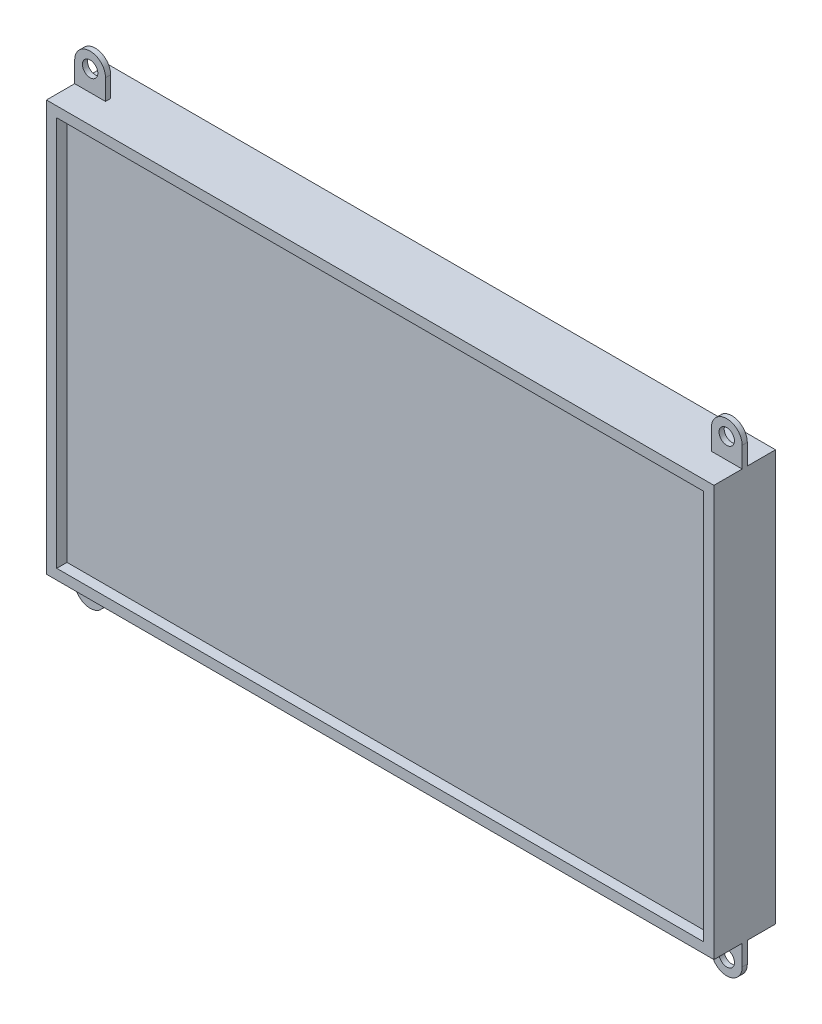
from build123d import *

# Parameters (mm, degrees)
SKETCH1_W               = 165.1
SKETCH1_H               = 101.6
BOSS_EXTRUDE1_DEPTH     = 7.62
SKETCH2_W               = 160.02
SKETCH2_H               = 96.52
CUT_EXTRUDE1_DEPTH      = 2.54
BOSS_EXTRUDE2_START     = -7.62
BOSS_EXTRUDE2_DEPTH     = 0.635
SKETCH4_R               = 1.905
CUT_EXTRUDE2_DEPTH      = 103.203442334
MIRROR2_START           = -7.62
MIRROR2_COPY_1_DEPTH    = 0.635
MIRROR2_COPY_2_SKETCH_R = 1.905
MIRROR2_COPY_2_DEPTH    = 103.203442334


with BuildPart() as part:
    # Sketch1 → Boss-Extrude1 (new, symmetric)
    with BuildSketch(Plane.XY):
        Rectangle(SKETCH1_W, SKETCH1_H)
    extrude(amount=BOSS_EXTRUDE1_DEPTH, both=True)

    # Sketch2 → Cut-Extrude1 (cut)
    with BuildSketch(Plane.XY.offset(7.62)):
        Rectangle(SKETCH2_W, SKETCH2_H)
    extrude(amount=-CUT_EXTRUDE1_DEPTH, mode=Mode.SUBTRACT)

    # Sketch3 → Boss-Extrude2 (add, symmetric)
    with BuildSketch(Plane(origin=(0, 0, -7.62), x_dir=(-1, 0, 0), z_dir=(0, 0, -1)).offset(BOSS_EXTRUDE2_START)):
        with BuildLine():
            Line((-82.55, 55.88), (-82.55, 50.8))
            Line((-82.55, 50.8), (-74.93, 50.8))
            Line((-74.93, 50.8), (-74.93, 55.88))
            ThreePointArc((-74.93, 55.88), (-78.74, 59.69), (-82.55, 55.88))
        make_face()
    boss_extrude2 = extrude(amount=BOSS_EXTRUDE2_DEPTH, both=True)

    # Sketch4 → Cut-Extrude2 (cut, through all)
    with BuildSketch(Plane.XY.offset(0.635)):
        with Locations((78.74, 55.88)):
            Circle(SKETCH4_R)
    cut_extrude2 = extrude(amount=-CUT_EXTRUDE2_DEPTH, mode=Mode.SUBTRACT)

    # Mirror1: Boss-Extrude2, Cut-Extrude2 across plane
    add(boss_extrude2.mirror(Plane.ZX))
    add(cut_extrude2.mirror(Plane.ZX), mode=Mode.SUBTRACT)

    # Mirror2: Boss-Extrude2, Cut-Extrude2 across plane
    add(boss_extrude2.mirror(Plane(origin=(0, 0, 0), x_dir=(0, 0, 1), z_dir=(1, 0, 0))))
    add(cut_extrude2.mirror(Plane(origin=(0, 0, 0), x_dir=(0, 0, 1), z_dir=(1, 0, 0))), mode=Mode.SUBTRACT)

    # Mirror2 copy 1 sketch → Mirror2 copy 1 (add, symmetric)
    with BuildSketch(Plane(origin=(0, 0, -7.62), x_dir=(1, 0, 0), z_dir=(0, 0, -1)).offset(MIRROR2_START)):
        with BuildLine():
            Line((-82.55, 55.88), (-82.55, 50.8))
            Line((-82.55, 50.8), (-74.93, 50.8))
            Line((-74.93, 50.8), (-74.93, 55.88))
            ThreePointArc((-74.93, 55.88), (-78.74, 59.69), (-82.55, 55.88))
        make_face()
    extrude(amount=MIRROR2_COPY_1_DEPTH, both=True)

    # Mirror2 copy 2 sketch → Mirror2 copy 2 (cut, through all)
    with BuildSketch(Plane(origin=(0, 0, 0.635), x_dir=(-1, 0, 0), z_dir=(0, 0, 1))):
        with Locations((78.74, 55.88)):
            Circle(MIRROR2_COPY_2_SKETCH_R)
    extrude(amount=-MIRROR2_COPY_2_DEPTH, mode=Mode.SUBTRACT)


solid = part.part
